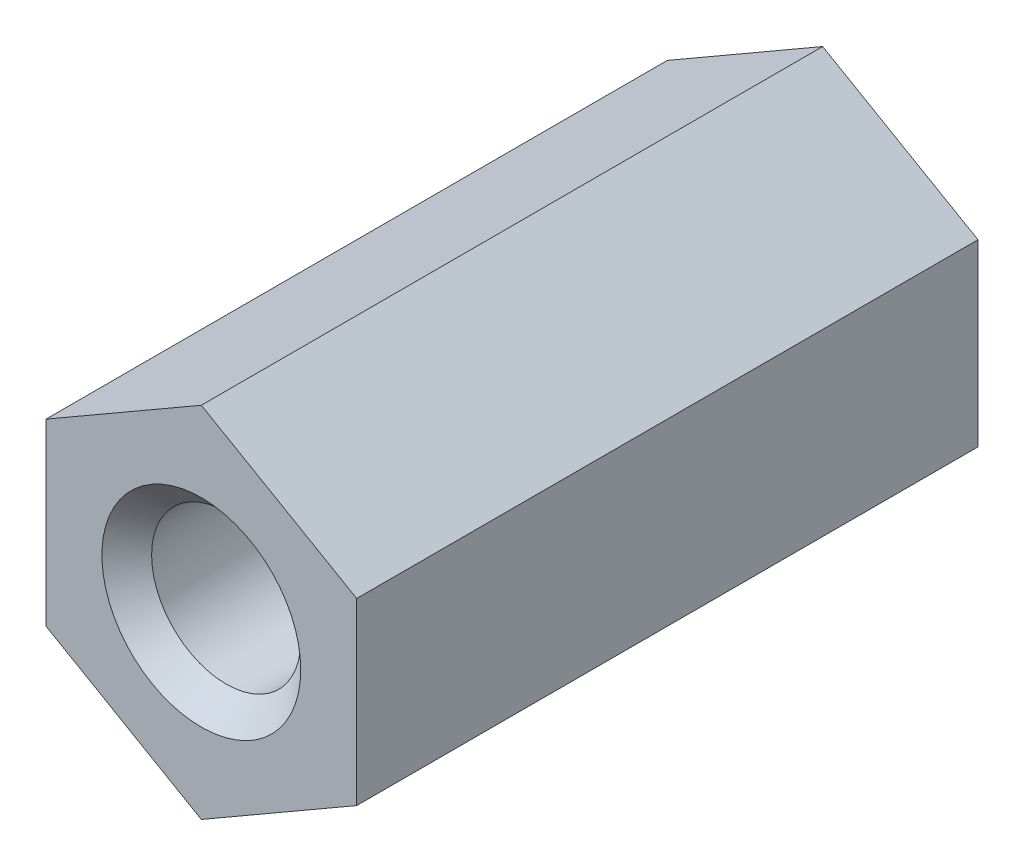
from build123d import *

# Parameters (mm, degrees)
SKETCH_1_R      = 1.2
EXTRUDE_1_DEPTH = 10
CHAMFER_1_SIZE  = 0.4


with BuildPart() as part:
    # Эскиз1 → Вытянуть1 (new body)
    with BuildSketch(Plane.XY):
        Polygon((0, 2.886751346), (-2.5, 1.443375673), (-2.5, -1.443375673), (0, -2.886751346), (2.5, -1.443375673), (2.5, 1.443375673), align=None)
        Circle(SKETCH_1_R, mode=Mode.SUBTRACT)
    extrude(amount=EXTRUDE_1_DEPTH)

    # Фаска1
    chamfer_1_edges = [part.edges().sort_by_distance(p)[0] for p in [
        (-1.2, 0, 0),
        (-1.2, 0, 10),
    ]]
    chamfer(chamfer_1_edges, length=CHAMFER_1_SIZE)


solid = part.part
